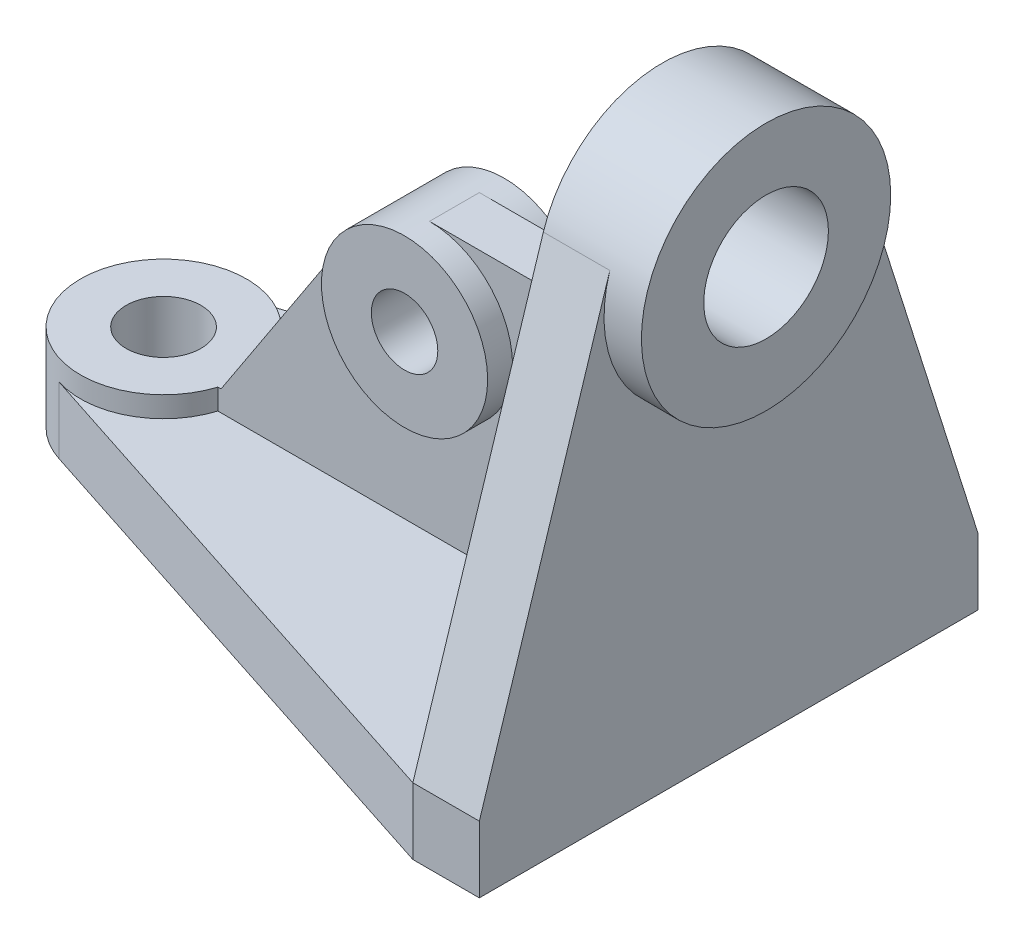
from build123d import *

# Parameters (mm, degrees)
SKETCH1_R           = 9
BOSS_EXTRUDE1_DEPTH = 21
BOSS_EXTRUDE2_DEPTH = 16
BOSS_EXTRUDE3_DEPTH = 16
BOSS_EXTRUDE4_START = 9
SKETCH2_3_R         = 15
BOSS_EXTRUDE4_DEPTH = 25
GURT_R              = 8
BOSS_EXTRUDE5_DEPTH = 12
BOSS_EXTRUDE6_DEPTH = 6
BOSS_EXTRUDE7_DEPTH = 5


with BuildPart() as part:
    # Sketch1 → Boss-Extrude1 (new body)
    with BuildSketch(Plane(origin=(0, 0, 0), x_dir=(1, 0, 0), z_dir=(0, 1, 0))):
        with BuildLine():
            ThreePointArc((-6.177666108, 19.021998882), (-20, 0), (-6.177666108, -19.021998882))
            ThreePointArc((-6.177666108, -19.021998882), (11.756842217, -16.179513623), (20, 0))
            ThreePointArc((20, 0), (11.756842217, 16.179513623), (-6.177666108, 19.021998882))
        make_face()
        Circle(SKETCH1_R, mode=Mode.SUBTRACT)
    extrude(amount=BOSS_EXTRUDE1_DEPTH)

    # Sketch1<3> → Boss-Extrude2 (add)
    with BuildSketch(Plane(origin=(0, 0, 0), x_dir=(1, 0, 0), z_dir=(0, 1, 0))):
        with BuildLine():
            ThreePointArc((-6.177666108, 19.021998882), (20, 0), (-6.177666108, -19.021998882))
            Line((-6.177666108, -19.021998882), (120, -60))
            Line((120, -60), (136, -60))
            Line((136, -60), (136, 60))
            Line((136, 60), (120, 60))
            Line((120, 60), (-6.177666108, 19.021998882))
        make_face()
    extrude(amount=BOSS_EXTRUDE2_DEPTH)

    # Sketch2 → Boss-Extrude3 (add)
    with BuildSketch(Plane(origin=(136, 0, 0), x_dir=(0, 0, -1), z_dir=(1, 0, 0))):
        with BuildLine():
            Line((-28.597626566, 115.065084378), (-60, 16))
            Line((-60, 16), (60, 16))
            Line((60, 16), (28.597626566, 115.065084378))
            ThreePointArc((28.597626566, 115.065084378), (29.64733375, 110.586458493), (30, 106))
            ThreePointArc((30, 106), (-4.586458493, 76.35266625), (-28.597626566, 115.065084378))
        make_face()
    extrude(amount=-BOSS_EXTRUDE3_DEPTH)

    # Sketch2<3> → Boss-Extrude4 (add)
    with BuildSketch(Plane(origin=(136, 0, 0), x_dir=(0, 0, -1), z_dir=(1, 0, 0)).offset(BOSS_EXTRUDE4_START)):
        with BuildLine():
            ThreePointArc((28.597626566, 115.065084378), (0, 136), (-28.597626566, 115.065084378))
            ThreePointArc((-28.597626566, 115.065084378), (-4.586458493, 76.35266625), (30, 106))
            ThreePointArc((30, 106), (29.64733375, 110.586458493), (28.597626566, 115.065084378))
        make_face()
        with Locations((0, 106)):
            Circle(SKETCH2_3_R, mode=Mode.SUBTRACT)
    extrude(amount=-BOSS_EXTRUDE4_DEPTH)



with BuildPart() as body_2:
    # gurt → Boss-Extrude5 (new, symmetric)
    with BuildSketch(Plane.XY):
        with BuildLine():
            ThreePointArc((90, 61), (84.142135624, 75.142135624), (70, 81))
            ThreePointArc((70, 81), (60.497728875, 78.598489807), (53.277437847, 71.970684347))
            ThreePointArc((53.277437847, 71.970684347), (64.275108868, 41.83686817), (90, 61))
        make_face()
        with Locations((70, 61)):
            Circle(GURT_R, mode=Mode.SUBTRACT)
    extrude(amount=BOSS_EXTRUDE5_DEPTH, both=True)


with BuildPart() as part_1:
    add(part.part)

    add(body_2.part)  # Boss-Extrude6 merges body 2
    # gurt<4> → Boss-Extrude6 (add, symmetric)
    with BuildSketch(Plane.XY):
        with BuildLine():
            Line((120, 81), (70, 81))
            ThreePointArc((70, 81), (84.142135624, 75.142135624), (90, 61))
            ThreePointArc((90, 61), (64.275108868, 41.83686817), (53.277437847, 71.970684347))
            Line((53.277437847, 71.970684347), (19.838585367, 21))
            Line((19.838585367, 21), (19.838585367, 16))
            Line((19.838585367, 16), (120, 16))
            Line((120, 16), (120, 81))
        make_face()
    extrude(amount=BOSS_EXTRUDE6_DEPTH, both=True)

    # Sketch4 → Boss-Extrude7 (add)
    with BuildSketch(Plane(origin=(0, 16, 0), x_dir=(1, 0, 0), z_dir=(0, 1, 0))):
        Polygon((19.838585367, 2.535849097), (19.838585367, 6), (18.936316569, 6), align=None)
        Polygon((19.838585367, -6), (18.936316569, -6), (19.838585367, -2.535849097), align=None)
    extrude(amount=BOSS_EXTRUDE7_DEPTH)


solid = part_1.part
